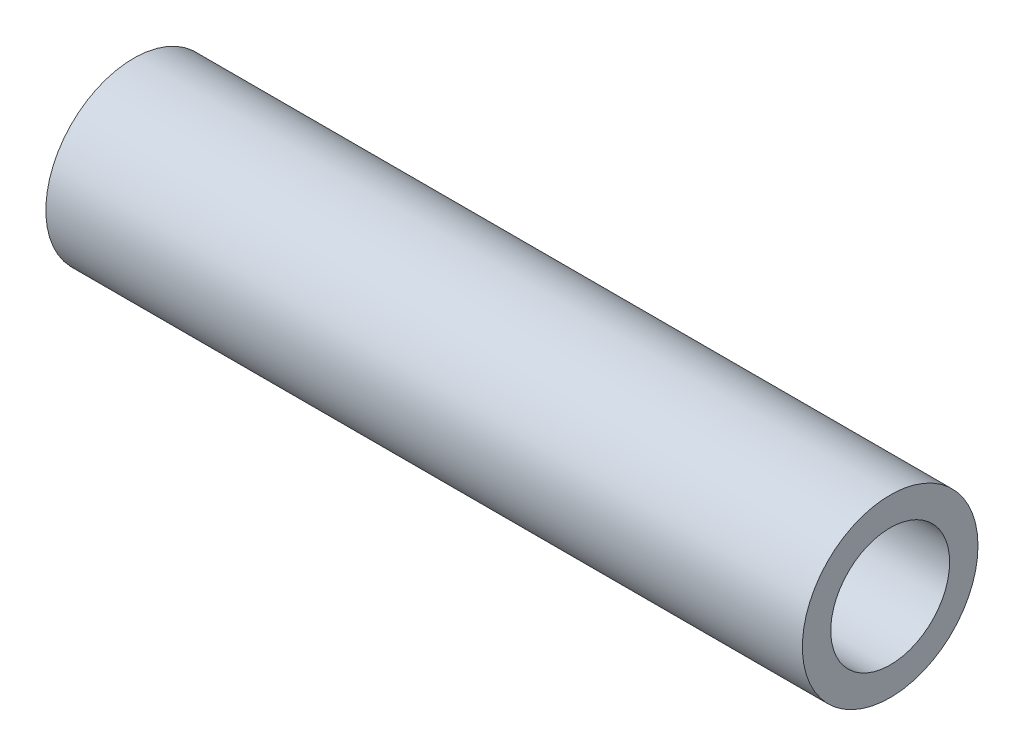
from build123d import *

# Parameters (mm, degrees)
SKETCH1_R           = 3.25
SKETCH1_R_2         = 2.2
BOSS_EXTRUDE1_DEPTH = 28


with BuildPart() as part:
    # Sketch1 → Boss-Extrude1 (new body)
    with BuildSketch(Plane(origin=(0, 0, 0), x_dir=(0, 0, -1), z_dir=(1, 0, 0))):
        Circle(SKETCH1_R)
        Circle(SKETCH1_R_2, mode=Mode.SUBTRACT)
    extrude(amount=BOSS_EXTRUDE1_DEPTH)


solid = part.part
